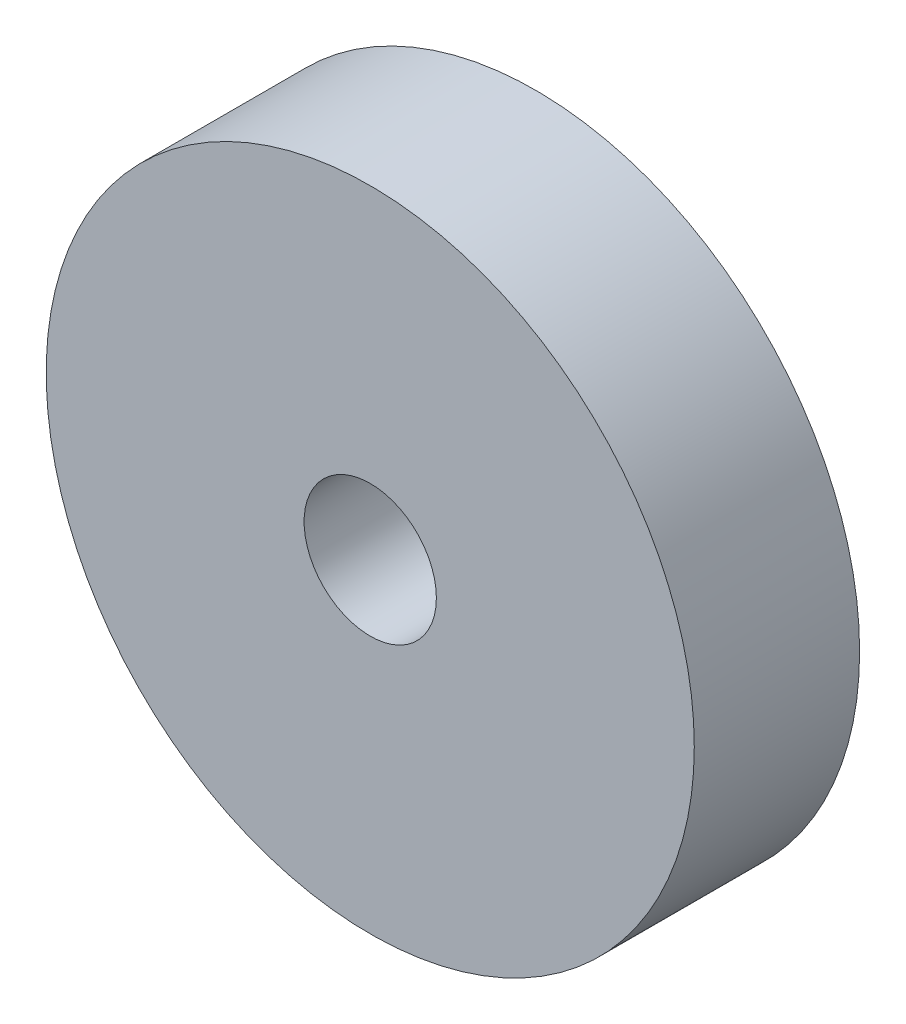
from build123d import *

# Parameters (mm, degrees)
SKETCH1_R           = 98
SKETCH1_R_2         = 20
BOSS_EXTRUDE1_DEPTH = 50


with BuildPart() as part:
    # Sketch1 → Boss-Extrude1 (new body)
    with BuildSketch(Plane.XY):
        Circle(SKETCH1_R)
        Circle(SKETCH1_R_2, mode=Mode.SUBTRACT)
    extrude(amount=BOSS_EXTRUDE1_DEPTH)


solid = part.part
